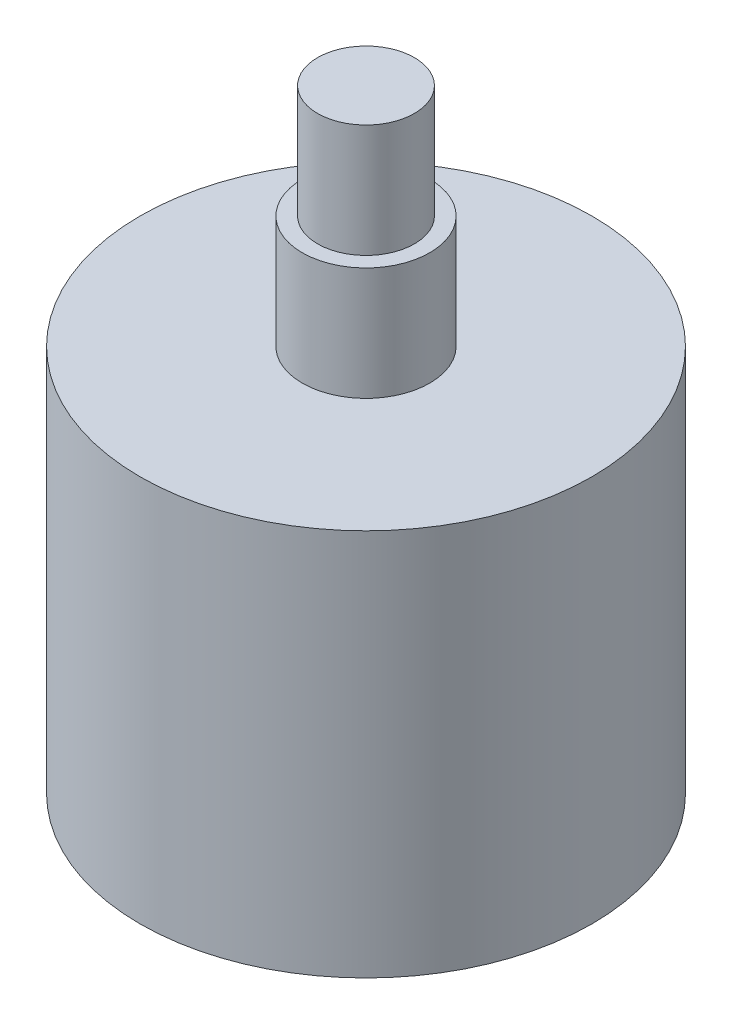
from build123d import *

# Parameters (mm, degrees)
SKETCH2_R           = 14
BOSS_EXTRUDE1_DEPTH = 24
SKETCH3_R           = 3.95
BOSS_EXTRUDE2_DEPTH = 7
SKETCH4_R           = 3
BOSS_EXTRUDE3_DEPTH = 7
SKETCH6_R           = 1.5
CUT_EXTRUDE1_DEPTH  = 5


with BuildPart() as part:
    # Sketch2 → Boss-Extrude1 (new body)
    with BuildSketch(Plane(origin=(0, 0, 0), x_dir=(1, 0, 0), z_dir=(0, 1, 0))):
        with Locations(Location((0, 0, 0), (0, 0, 270))):
            Circle(SKETCH2_R)
    extrude(amount=BOSS_EXTRUDE1_DEPTH)

    # Sketch3 → Boss-Extrude2 (add)
    with BuildSketch(Plane(origin=(0, 24, 0), x_dir=(1, 0, 0), z_dir=(0, 1, 0))):
        with Locations(Location((0, 0, 0), (0, 0, 270))):
            Circle(SKETCH3_R)
    extrude(amount=BOSS_EXTRUDE2_DEPTH)

    # Sketch4 → Boss-Extrude3 (add)
    with BuildSketch(Plane(origin=(0, 31, 0), x_dir=(1, 0, 0), z_dir=(0, 1, 0))):
        with Locations(Location((0, 0, 0), (0, 0, 270))):
            Circle(SKETCH4_R)
    extrude(amount=BOSS_EXTRUDE3_DEPTH)

    # Sketch6 → Cut-Extrude1 (cut)
    with BuildSketch(Plane.XZ):
        with Locations(Location((9.5, 0, 0), (0, 0, 270))):
            Circle(SKETCH6_R)
        with Locations(Location((0, -9.5, 0), (0, 0, 270))):
            Circle(SKETCH6_R)
        with Locations(Location((-9.5, 0, 0), (0, 0, 270))):
            Circle(SKETCH6_R)
        with Locations(Location((0, 9.5, 0), (0, 0, 270))):
            Circle(SKETCH6_R)
    extrude(amount=-CUT_EXTRUDE1_DEPTH, mode=Mode.SUBTRACT)


solid = part.part
